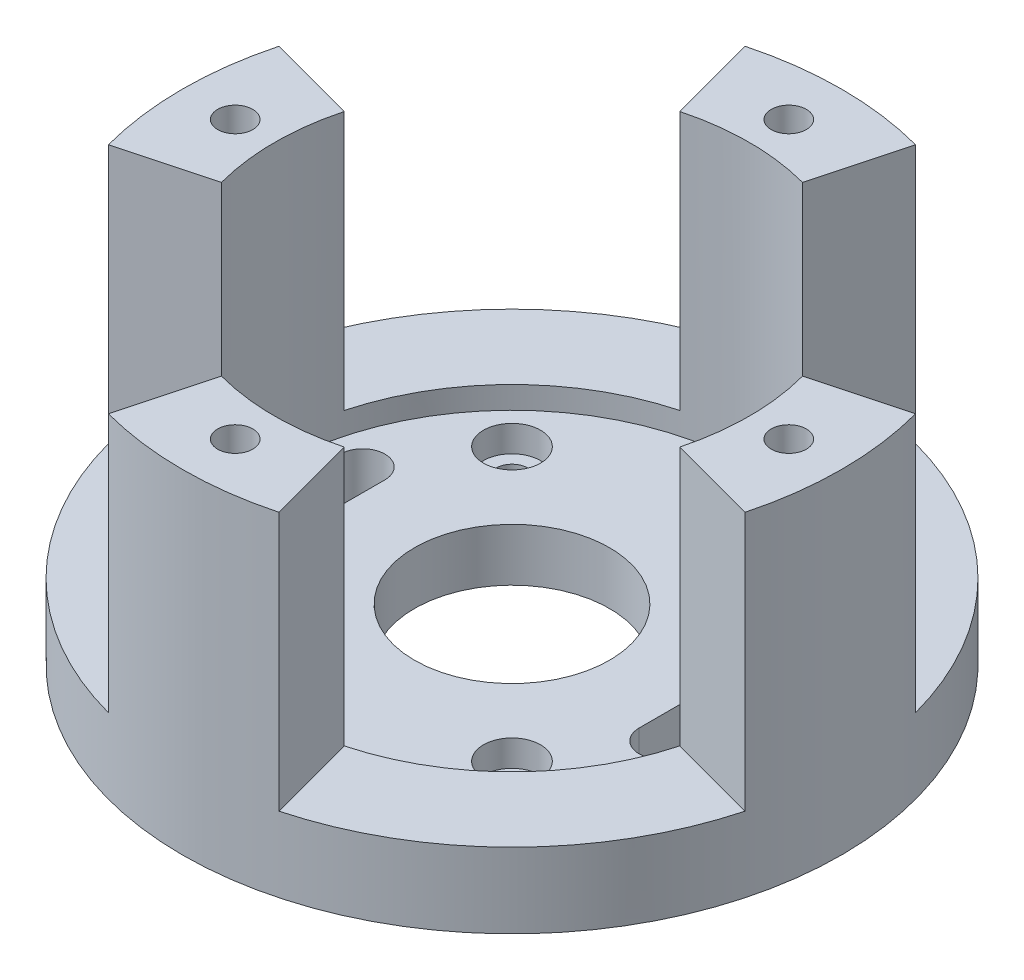
from build123d import *

# Parameters (mm, degrees)
SKETCH1_R                      = 37.5
BOSS_EXTRUDE1_DEPTH            = 6
CBORE_FOR_M3_SHCS1_D           = 3.6
CBORE_FOR_M3_SHCS1_DEPTH       = 6.500114
CBORE_FOR_M3_SHCS1_CBORE_D     = 6.5
CBORE_FOR_M3_SHCS1_CBORE_DEPTH = 3
CBORE_FOR_M3_SHCS1_TIP         = 1.081549114
SKETCH7_R                      = 11.1016
CUT_EXTRUDE3_DEPTH             = 54.371340624
SKETCH8_R                      = 37.5
SKETCH8_R_2                    = 27
BOSS_EXTRUDE2_DEPTH            = 31.99999998
SKETCH5_R                      = 2.5273
CUT_EXTRUDE1_DEPTH             = 27.94
SKETCH6_R                      = 2
CUT_EXTRUDE2_DEPTH             = 60.942836102
CIRPATTERN1_COUNT              = 4
SKETCH9_R                      = 4
CUT_EXTRUDE4_DEPTH             = 24.14
CHAMFER1_SIZE                  = 0.762
CUT_EXTRUDE5_DEPTH             = 66.241857718
CUT_EXTRUDE6_START             = -29.45999998
CUT_EXTRUDE6_DEPTH             = 29.45999998
CIRPATTERN2_COUNT              = 4


with BuildPart() as part:
    # Sketch1 → Boss-Extrude1 (new body)
    with BuildSketch(Plane(origin=(0, 0, 0), x_dir=(1, 0, 0), z_dir=(0, 1, 0))):
        with Locations(Location((0, 0, 0), (0, 0, 270))):
            Circle(SKETCH1_R)
    extrude(amount=BOSS_EXTRUDE1_DEPTH)

    # CBORE for M3 SHCS1
    with Locations(Plane(origin=(0, 6, 0), x_dir=(1, 0, 0), z_dir=(0, 1, 0))):
        with Locations((-15.50195, 15.50195), (15.50195, 15.50195), (15.50195, -15.50195), (-15.50195, -15.50195)):
            CounterBoreHole(CBORE_FOR_M3_SHCS1_D / 2, CBORE_FOR_M3_SHCS1_CBORE_D / 2, CBORE_FOR_M3_SHCS1_CBORE_DEPTH, depth=CBORE_FOR_M3_SHCS1_DEPTH)
            with Locations((0, 0, -(CBORE_FOR_M3_SHCS1_DEPTH + CBORE_FOR_M3_SHCS1_TIP / 2))):  # 118° drill point
                Cone(0, CBORE_FOR_M3_SHCS1_D / 2, CBORE_FOR_M3_SHCS1_TIP, mode=Mode.SUBTRACT)

    # Sketch7 → Cut-Extrude3 (cut, through all)
    with BuildSketch(Plane(origin=(0, 6, 0), x_dir=(1, 0, 0), z_dir=(0, 1, 0))):
        with Locations(Location((0, 0, 0), (0, 0, 270))):
            Circle(SKETCH7_R)
    extrude(amount=-CUT_EXTRUDE3_DEPTH, mode=Mode.SUBTRACT)

    # Sketch8 → Boss-Extrude2 (add)
    with BuildSketch(Plane(origin=(0, 6, 0), x_dir=(1, 0, 0), z_dir=(0, 1, 0))):
        with Locations(Location((0, 0, 0), (0, 0, 270))):
            Circle(SKETCH8_R)
        with Locations(Location((0, 0, 0), (0, 0, 270))):
            Circle(SKETCH8_R_2, mode=Mode.SUBTRACT)
    extrude(amount=BOSS_EXTRUDE2_DEPTH)

    # Sketch5 → Cut-Extrude1 (cut)
    with BuildSketch(Plane(origin=(0, 0, 0), x_dir=(1, 0, 0), z_dir=(0, 1, 0))):
        with Locations(Location((0, 31.5, 0), (0, 0, 270))):
            Circle(SKETCH5_R)
    cut_extrude1 = extrude(amount=CUT_EXTRUDE1_DEPTH, mode=Mode.SUBTRACT)

    # Sketch6 → Cut-Extrude2 (cut, through all)
    with BuildSketch(Plane(origin=(0, 27.94, 0), x_dir=(-1, 0, 0), z_dir=(0, -1, 0))):
        with Locations(Location((0, 31.5, 0), (0, 0, 90))):
            Circle(SKETCH6_R)
    cut_extrude2 = extrude(amount=-CUT_EXTRUDE2_DEPTH, mode=Mode.SUBTRACT)

    # CirPattern1: Cut-Extrude1, Cut-Extrude2 ×4 about axis
    cirpattern1_axis = Axis((0, 0, 0), (0, 1, 0))
    add([cut_extrude1.rotate(cirpattern1_axis, i * 360 / CIRPATTERN1_COUNT) for i in range(1, CIRPATTERN1_COUNT)], mode=Mode.SUBTRACT)
    add([cut_extrude2.rotate(cirpattern1_axis, i * 360 / CIRPATTERN1_COUNT) for i in range(1, CIRPATTERN1_COUNT)], mode=Mode.SUBTRACT)

    # Sketch9 → Cut-Extrude4 (cut)
    with BuildSketch(Plane.XZ):
        with Locations(Location((31.5, 0, 0), (0, 0, 270))):
            Circle(SKETCH9_R)
        with Locations(Location((0, -31.5, 0), (0, 0, 270))):
            Circle(SKETCH9_R)
        with Locations(Location((-31.5, 0, 0), (0, 0, 270))):
            Circle(SKETCH9_R)
        with Locations(Location((0, 31.5, 0), (0, 0, 270))):
            Circle(SKETCH9_R)
    extrude(amount=-CUT_EXTRUDE4_DEPTH, mode=Mode.SUBTRACT)

    # Chamfer1
    chamfer1_edges = [part.edges().sort_by_distance(p)[0] for p in [
        (34.0273, 24.14, 0),
        (0, 24.14, -34.0273),
        (-34.0273, 24.14, 0),
        (0, 24.14, 34.0273),
    ]]
    chamfer(chamfer1_edges, length=CHAMFER1_SIZE)

    # Sketch10 → Cut-Extrude5 (cut, through all)
    with BuildSketch(Plane.XZ):
        with BuildLine():
            Line((-19.46, 5), (-19.46, -5))
            ThreePointArc((-19.46, -5), (-22, -7.54), (-24.54, -5))
            Line((-24.54, -5), (-24.54, 5))
            ThreePointArc((-24.54, 5), (-22, 7.54), (-19.46, 5))
        make_face()
    cut_extrude5 = extrude(amount=-CUT_EXTRUDE5_DEPTH, mode=Mode.SUBTRACT)

    # Mirror1: Cut-Extrude5 across plane
    add(cut_extrude5.mirror(Plane(origin=(0, 0, 0), x_dir=(0, 0, 1), z_dir=(1, 0, 0))), mode=Mode.SUBTRACT)

    # Sketch12 → Cut-Extrude6 (cut)
    with BuildSketch(Plane(origin=(0, 37.99999998, 0), x_dir=(1, 0, 0), z_dir=(0, 1, 0)).offset(CUT_EXTRUDE6_START)):
        with BuildLine():
            Line((-26.07999731, 6.988114218), (-36.222218486, 9.705714191))
            ThreePointArc((-36.222218486, 9.705714191), (-26.516504294, 26.516504294), (-9.705714191, 36.222218486))
            Line((-9.705714191, 36.222218486), (-6.988114218, 26.07999731))
            ThreePointArc((-6.988114218, 26.07999731), (-19.091883092, 19.091883092), (-26.07999731, 6.988114218))
        make_face()
    cut_extrude6 = extrude(amount=CUT_EXTRUDE6_DEPTH, mode=Mode.SUBTRACT)

    # CirPattern2: Cut-Extrude6 ×4 about axis
    cirpattern2_axis = Axis((0, 182.066017138, 0), (0, -1, 0))
    for i in range(1, CIRPATTERN2_COUNT):
        add(cut_extrude6.rotate(cirpattern2_axis, i * 360 / CIRPATTERN2_COUNT), mode=Mode.SUBTRACT)


solid = part.part
